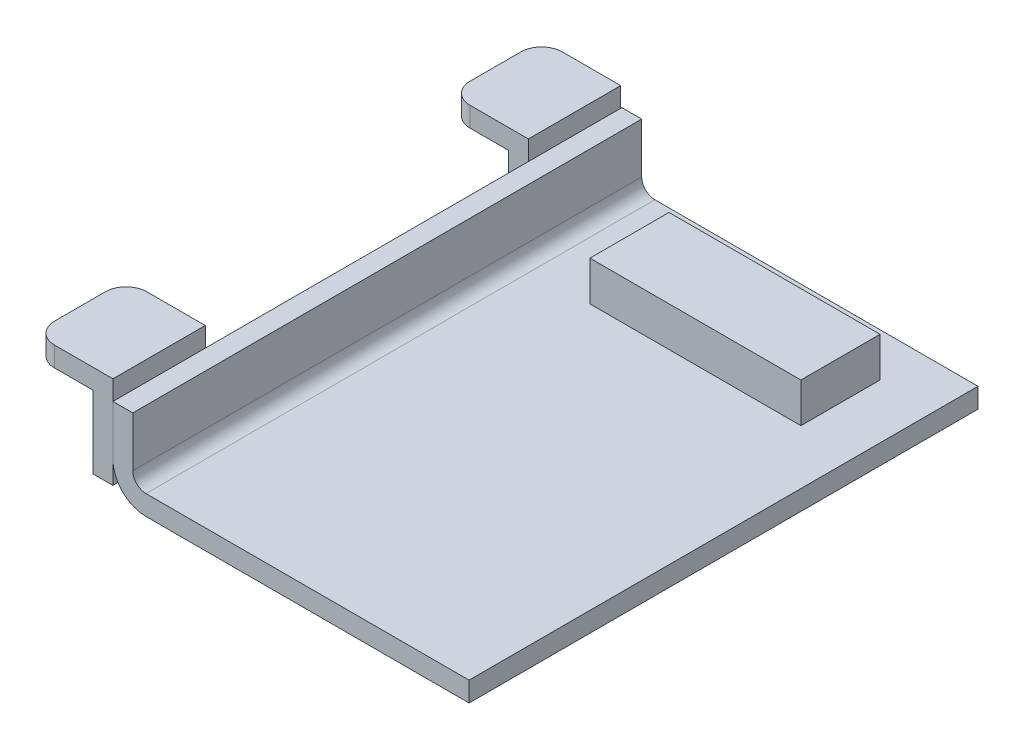
from build123d import *

# Parameters (mm, degrees)
EXTRUDE1_DEPTH      = 61.25
EXTRUDE1_DEPTH_BACK = 61.25
FILLET1_R           = 3.175
FILLET2_R           = 7.9375
EXTRUDE2_DEPTH      = 22.225
FILLET3_R           = 5
SKETCH35_W          = 50.8
SKETCH35_H          = 19.05
EXTRUDE3_DEPTH      = 9.525
LPATTERN7_COUNT     = 2
LPATTERN7_PITCH     = 100


with BuildPart() as part:
    # Sketch1 → Extrude1 (new, two sides: drawn at the far end of the back side and taken through both)
    with BuildSketch(Plane.XY.offset(-EXTRUDE1_DEPTH_BACK)):
        Polygon((0, 0), (0, 20), (4.7752, 20), (4.7752, 4.7752), (85.725, 4.7752), (85.725, 0), align=None)
    extrude(amount=EXTRUDE1_DEPTH + EXTRUDE1_DEPTH_BACK)

    # Fillet1
    fillet1_edges = [part.edges().sort_by_distance(p)[0] for p in [
        (4.7752, 4.7752, 0),
    ]]
    fillet(fillet1_edges, radius=FILLET1_R)

    # Fillet2
    fillet2_edges = [part.edges().sort_by_distance(p)[0] for p in [
        (0, 0, 0),
    ]]
    fillet(fillet2_edges, radius=FILLET2_R)


with BuildPart() as body_2:
    # Sketch34 → Extrude2 (new body)
    with BuildSketch(Plane(origin=(0, 0, -60.975), x_dir=(-1, 0, 0), z_dir=(0, 0, -1))):
        Polygon((0, 2.4999), (0, 24.7249), (19.05, 24.7249), (19.05, 19.9497), (4.7752, 19.9497), (4.7752, 2.4999), align=None)
    extrude(amount=-EXTRUDE2_DEPTH)

    # Fillet3
    fillet3_edges = [body_2.edges().sort_by_distance(p)[0] for p in [
        (-19.05, 22.3373, -38.75),
        (-19.05, 22.3373, -60.975),
    ]]
    fillet(fillet3_edges, radius=FILLET3_R)


with BuildPart() as body_3:
    # Sketch35 → Extrude3 (new body)
    with BuildSketch(Plane(origin=(0, 4.7752, 0), x_dir=(1, 0, 0), z_dir=(0, 1, 0))):
        with Locations((47.2248, 41.25)):
            Rectangle(SKETCH35_W, SKETCH35_H)
    extrude(amount=EXTRUDE3_DEPTH)


with BuildPart() as lpattern7_1:
    # LPattern7: pattern copy
    add(body_2.part.moved(Location(Vector(0, 0, 1) * (1 * LPATTERN7_PITCH))))


solid = Compound([part.part, body_2.part, body_3.part, lpattern7_1.part])
